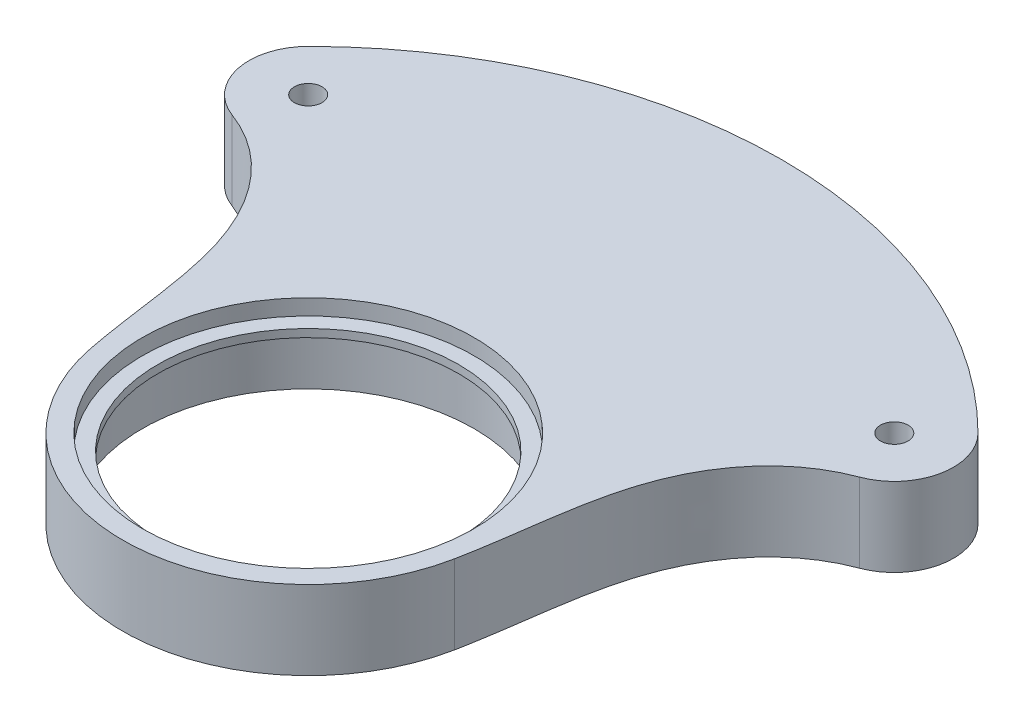
from build123d import *

# Parameters (mm, degrees)
SKETCH2_R           = 21
BOSS_EXTRUDE1_DEPTH = 10
CUT_EXTRUDE1_REACH  = 77.44
SKETCH3_R           = 1.75
SKETCH5_W           = 4
SKETCH5_H           = 1


with BuildPart() as part:
    # Sketch2 → Boss-Extrude1 (new body)
    # profile 1 of 6: a face of its own
    with BuildSketch(Plane(origin=(0, 0, 0), x_dir=(1, 0, 0), z_dir=(0, 1, 0))):
        with BuildLine():
            ThreePointArc((-39.742001703, 30.095205518), (-35.527778851, 29.794741171), (-31.819805153, 31.819805153))
            Line((-31.819805153, 31.819805153), (-42.426406871, 42.426406871))
            ThreePointArc((-42.426406871, 42.426406871), (-44.451470854, 35.527778851), (-39.742001703, 30.095205518))
        make_face()
    # profile 2 of 6: a face of its own
    with BuildSketch(Plane(origin=(0, 0, 0), x_dir=(1, 0, 0), z_dir=(0, 1, 0))):
        with BuildLine():
            Line((-42.426406871, 42.426406871), (-31.819805153, 31.819805153))
            ThreePointArc((-31.819805153, 31.819805153), (0, 45), (31.819805153, 31.819805153))
            ThreePointArc((31.819805153, 31.819805153), (35.527778851, 29.794741171), (39.742001703, 30.095205518))
            ThreePointArc((39.742001703, 30.095205518), (44.451470854, 35.527778851), (42.426406871, 42.426406871))
            ThreePointArc((42.426406871, 42.426406871), (0, 60), (-42.426406871, 42.426406871))
        make_face()
    # profile 3 of 6: a face of its own
    with BuildSketch(Plane(origin=(0, 0, 0), x_dir=(1, 0, 0), z_dir=(0, 1, 0))):
        with BuildLine():
            ThreePointArc((31.819805153, 31.819805153), (0, 45), (-31.819805153, 31.819805153))
            ThreePointArc((-31.819805153, 31.819805153), (-33.665365801, 29.860394262), (-35.390472848, 27.794143836))
            add(Edge.make_bspline(
                [(-35.390472848, 27.794143836), (-32.245912853, 25.570807212), (-24.806129807, 15.839794796), (-24.750821328, 4.074395815), (-23.058627279, -4.533178579)],
                knots=[0.115209689, 0.115209689, 0.115209689, 0.115209689, 0.392292763, 1, 1, 1, 1], degree=3))
            ThreePointArc((-23.058627279, -4.533178579), (-2.277307506, 23.38939654), (23.5, 0))
            ThreePointArc((23.5, 0), (23.38939654, -2.277307506), (23.058627279, -4.533178579))
            add(Edge.make_bspline(
                [(35.390472848, 27.794143836), (32.245912853, 25.570807212), (24.806129807, 15.839794796), (24.750821328, 4.074395815), (23.058627279, -4.533178579)],
                knots=[0.115209689, 0.115209689, 0.115209689, 0.115209689, 0.392292763, 1, 1, 1, 1], degree=3))
            ThreePointArc((35.390472848, 27.794143836), (33.665365801, 29.860394262), (31.819805153, 31.819805153))
        make_face()
    # profile 4 of 6: a face of its own
    with BuildSketch(Plane(origin=(0, 0, 0), x_dir=(1, 0, 0), z_dir=(0, 1, 0))):
        with BuildLine():
            ThreePointArc((-35.390472848, 27.794143836), (-33.665365801, 29.860394262), (-31.819805153, 31.819805153))
            ThreePointArc((-31.819805153, 31.819805153), (-35.527778851, 29.794741171), (-39.742001703, 30.095205518))
            add(Edge.make_bspline(
                [(-39.742001703, 30.095205518), (-38.146305527, 29.500581015), (-36.697964408, 28.718595549), (-35.390472848, 27.794143836)],
                knots=[0, 0, 0, 0, 0.115209689, 0.115209689, 0.115209689, 0.115209689], degree=3))
        make_face()
    # profile 5 of 6: a face of its own
    with BuildSketch(Plane(origin=(0, 0, 0), x_dir=(1, 0, 0), z_dir=(0, 1, 0))):
        with BuildLine():
            ThreePointArc((39.742001703, 30.095205518), (35.527778851, 29.794741171), (31.819805153, 31.819805153))
            ThreePointArc((31.819805153, 31.819805153), (33.665365801, 29.860394262), (35.390472848, 27.794143836))
            add(Edge.make_bspline(
                [(39.742001703, 30.095205518), (38.146305527, 29.500581015), (36.697964408, 28.718595549), (35.390472848, 27.794143836)],
                knots=[0, 0, 0, 0, 0.115209689, 0.115209689, 0.115209689, 0.115209689], degree=3))
        make_face()
    # profile 6 of 6: a face of its own
    with BuildSketch(Plane(origin=(0, 0, 0), x_dir=(1, 0, 0), z_dir=(0, 1, 0))):
        with BuildLine():
            ThreePointArc((23.5, 0), (-2.277307506, 23.38939654), (-23.058627279, -4.533178579))
            ThreePointArc((-23.058627279, -4.533178579), (0, -23.5), (23.058627279, -4.533178579))
            ThreePointArc((23.058627279, -4.533178579), (23.38939654, -2.277307506), (23.5, 0))
        make_face()
        with Locations(Location((0, 0, 0), (0, 0, 270))):
            Circle(SKETCH2_R, mode=Mode.SUBTRACT)
    extrude(amount=BOSS_EXTRUDE1_DEPTH)

    # Sketch3 → Cut-Extrude1 (cut, up to next)
    with BuildSketch(Plane(origin=(0, 10, 0), x_dir=(1, 0, 0), z_dir=(0, 1, 0)), mode=Mode.PRIVATE) as cut_extrude1_sk1:
        with Locations(Location((-37.123106012, 37.123106012, 0), (0, 0, 270))):
            Circle(SKETCH3_R)
    cut_extrude1_tool1 = extrude(cut_extrude1_sk1.sketch, amount=-CUT_EXTRUDE1_REACH, mode=Mode.PRIVATE) & part.part
    # Sketch3 → Cut-Extrude1 (cut, up to next)
    with BuildSketch(Plane(origin=(0, 10, 0), x_dir=(1, 0, 0), z_dir=(0, 1, 0)), mode=Mode.PRIVATE) as cut_extrude1_sk2:
        with Locations(Location((37.123106012, 37.123106012, 0), (0, 0, 270))):
            Circle(SKETCH3_R)
    cut_extrude1_tool2 = extrude(cut_extrude1_sk2.sketch, amount=-CUT_EXTRUDE1_REACH, mode=Mode.PRIVATE) & part.part
    add(cut_extrude1_tool1.solids().sort_by_distance((-37.123106, 10, -37.123106))[0], mode=Mode.SUBTRACT)
    add(cut_extrude1_tool2.solids().sort_by_distance((37.123106, 10, -37.123106))[0], mode=Mode.SUBTRACT)

    # Sketch5 → Revolve1 (revolve)
    with BuildSketch(Plane.XY, mode=Mode.PRIVATE) as revolve1_sk:
        with Locations((-21.058627279, 7.5)):
            Rectangle(SKETCH5_W, SKETCH5_H)
    revolve(revolve1_sk.sketch.rotate(Axis((0, 10, 0), (0, -1, 0)), 270), axis=Axis((0, 10, 0), (0, -1, 0)))


solid = part.part
